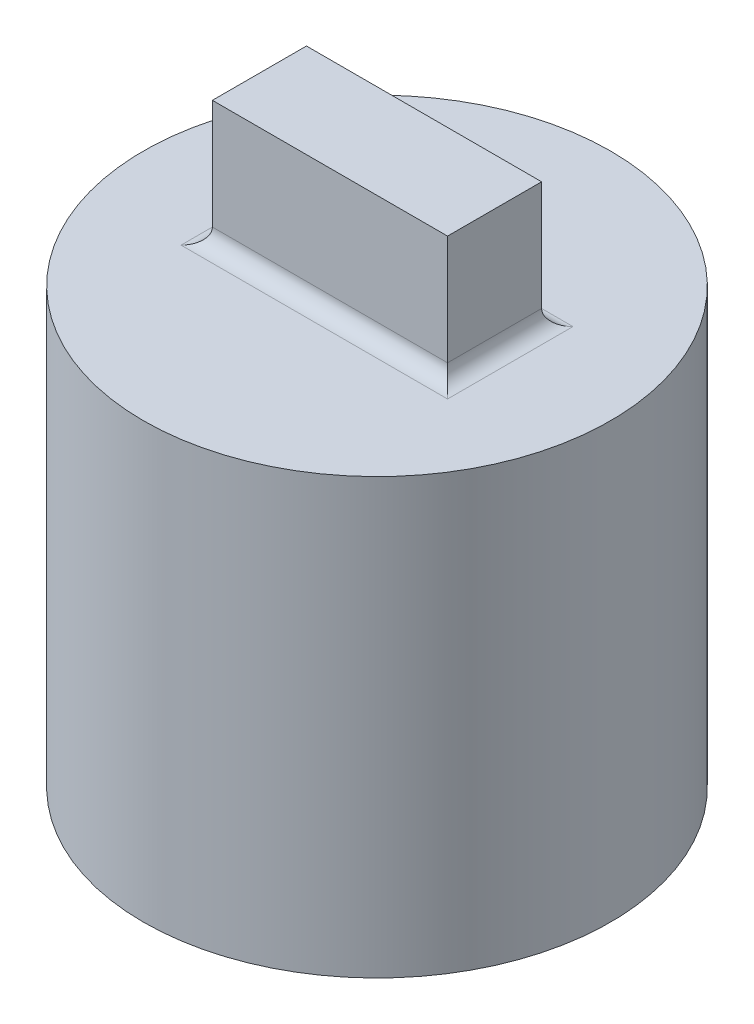
from build123d import *

# Parameters (mm, degrees)
SKETCH1_R                = 14.9
BOSS_EXTRUDE1_DEPTH      = 27.7
SKETCH2_R                = 13.4
CUT_EXTRUDE1_DEPTH       = 10
BOSS_EXTRUDE2_DEPTH      = 3
BOSS_EXTRUDE2_DEPTH_BACK = 3
SKETCH3_W                = 15
SKETCH3_H                = 8
FILLET1_R                = 1


with BuildPart() as part:
    # Sketch1 → Boss-Extrude1 (new body)
    with BuildSketch(Plane(origin=(0, 0, 0), x_dir=(1, 0, 0), z_dir=(0, 1, 0))):
        Circle(SKETCH1_R)
    extrude(amount=BOSS_EXTRUDE1_DEPTH)

    # Sketch2 → Cut-Extrude1 (cut)
    with BuildSketch(Plane.XZ):
        Circle(SKETCH2_R)
    extrude(amount=-CUT_EXTRUDE1_DEPTH, mode=Mode.SUBTRACT)

    # Sketch3 → Boss-Extrude2 (add, two sides: drawn at the far end of the back side and taken through both)
    with BuildSketch(Plane.XY.offset(-BOSS_EXTRUDE2_DEPTH_BACK)):
        with Locations((0, 31.7)):
            Rectangle(SKETCH3_W, SKETCH3_H)
    extrude(amount=BOSS_EXTRUDE2_DEPTH + BOSS_EXTRUDE2_DEPTH_BACK)

    # Fillet1
    fillet1_edges = [part.edges().sort_by_distance(p)[0] for p in [
        (7.5, 27.7, 0),
        (0, 27.7, -3),
        (-7.5, 27.7, 0),
        (0, 27.7, 3),
    ]]
    fillet(fillet1_edges, radius=FILLET1_R)


solid = part.part
